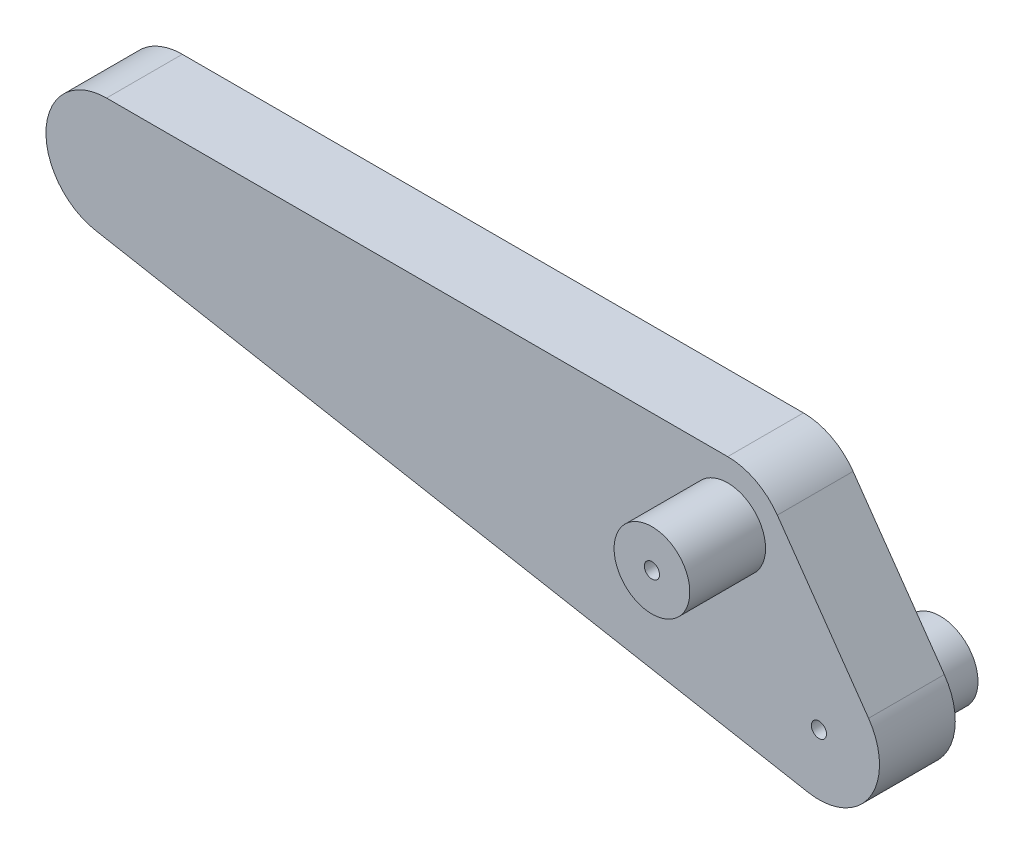
from build123d import *

# Parameters (mm, degrees)
SKETCH2_R           = 2.5
BOSS_EXTRUDE1_DEPTH = 5
BOSS_EXTRUDE2_START = -8
SKETCH3_R           = 2.5
SKETCH3_R_2         = 0.5
BOSS_EXTRUDE2_DEPTH = 8
SKETCH4_R           = 2.5
SKETCH4_R_2         = 0.5
BOSS_EXTRUDE3_DEPTH = 10


with BuildPart() as part:
    # Sketch2 → Boss-Extrude1 (new body)
    with BuildSketch(Plane.XY):
        with BuildLine():
            Line((-41, 4), (0, 4))
            ThreePointArc((0, 4), (1.846994453, 3.548043333), (3.276608177, 2.294305745))
            Line((3.276608177, 2.294305745), (9.299160759, -6.30679072))
            ThreePointArc((9.299160759, -6.30679072), (9.389243762, -10.761047968), (5.302836395, -12.53581483))
            Line((5.302836395, -12.53581483), (-41.719716186, -3.934718365))
            ThreePointArc((-41.719716186, -3.934718365), (-44.98364616, 0.361335399), (-41, 4))
        make_face()
        Circle(SKETCH2_R, mode=Mode.SUBTRACT)
        with Locations((6.022552582, -8.601096465)):
            Circle(SKETCH2_R, mode=Mode.SUBTRACT)
    extrude(amount=BOSS_EXTRUDE1_DEPTH)

    # Sketch3 → Boss-Extrude2 (add)
    with BuildSketch(Plane.XY.offset(5).offset(BOSS_EXTRUDE2_START)):
        with Locations((6.022552582, -8.601096465)):
            Circle(SKETCH3_R)
        with Locations((6.022552582, -8.601096465)):
            Circle(SKETCH3_R_2, mode=Mode.SUBTRACT)
    extrude(amount=BOSS_EXTRUDE2_DEPTH)

    # Sketch4 → Boss-Extrude3 (add)
    with BuildSketch(Plane(origin=(0, 0, 0), x_dir=(-1, 0, 0), z_dir=(0, 0, -1))):
        Circle(SKETCH4_R)
        Circle(SKETCH4_R_2, mode=Mode.SUBTRACT)
    extrude(amount=-BOSS_EXTRUDE3_DEPTH)


solid = part.part
